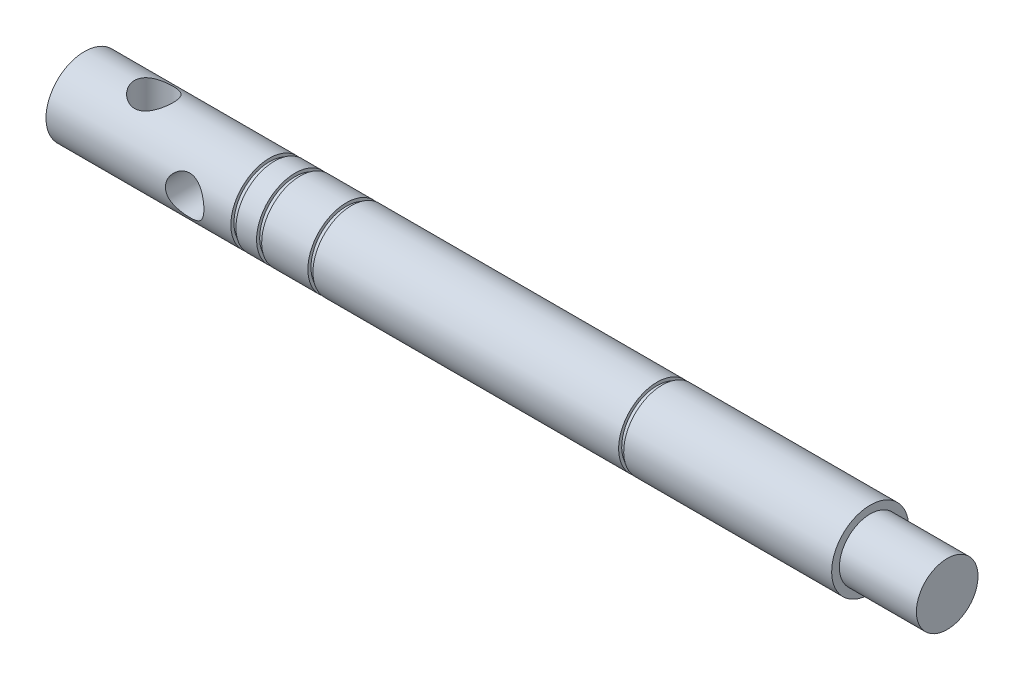
from build123d import *

# Parameters (mm, degrees)
CUT_EXTRUDE1_DEPTH      = 113.222992297
CUT_EXTRUDE1_DEPTH_BACK = 113.222992297
SKETCH2_R               = 2.5
CUT_EXTRUDE2_DEPTH      = 113.222992405
CUT_EXTRUDE2_DEPTH_BACK = 113.222992405
SKETCH4_R               = 2.5


with BuildPart() as part:
    # Sketch1 → Revolve1 (revolve)
    with BuildSketch(Plane.XY):
        Polygon((0, 0), (0, 4), (-10, 4), (-10, 5), (-37, 5), (-37, 4.6), (-37.66, 4.6), (-37.66, 5), (-77.34, 5), (-77.34, 4.6), (-78, 4.6), (-78, 5), (-84, 5), (-84, 4.6), (-84.66, 4.6), (-84.66, 5), (-87.34, 5), (-87.34, 4.6), (-88, 4.6), (-88, 5), (-112, 5), (-112, 0), align=None)
    revolve(axis=Axis((0, 0, 0), (-1, 0, 0)))

    # Sketch2 → Cut-Extrude1 (cut, two sides: drawn at the far end of the back side and taken through both)
    with BuildSketch(Plane(origin=(0, 0, 0), x_dir=(1, 0, 0), z_dir=(0, 1, 0)).offset(-CUT_EXTRUDE1_DEPTH_BACK)):
        with Locations((-103, 0)):
            Circle(SKETCH2_R)
    extrude(amount=CUT_EXTRUDE1_DEPTH + CUT_EXTRUDE1_DEPTH_BACK, mode=Mode.SUBTRACT)

    # Sketch4 → Cut-Extrude2 (cut, two sides: drawn at the far end of the back side and taken through both)
    with BuildSketch(Plane.XY.offset(-CUT_EXTRUDE2_DEPTH_BACK)):
        with Locations((-94, 0)):
            Circle(SKETCH4_R)
    extrude(amount=CUT_EXTRUDE2_DEPTH + CUT_EXTRUDE2_DEPTH_BACK, mode=Mode.SUBTRACT)


solid = part.part
